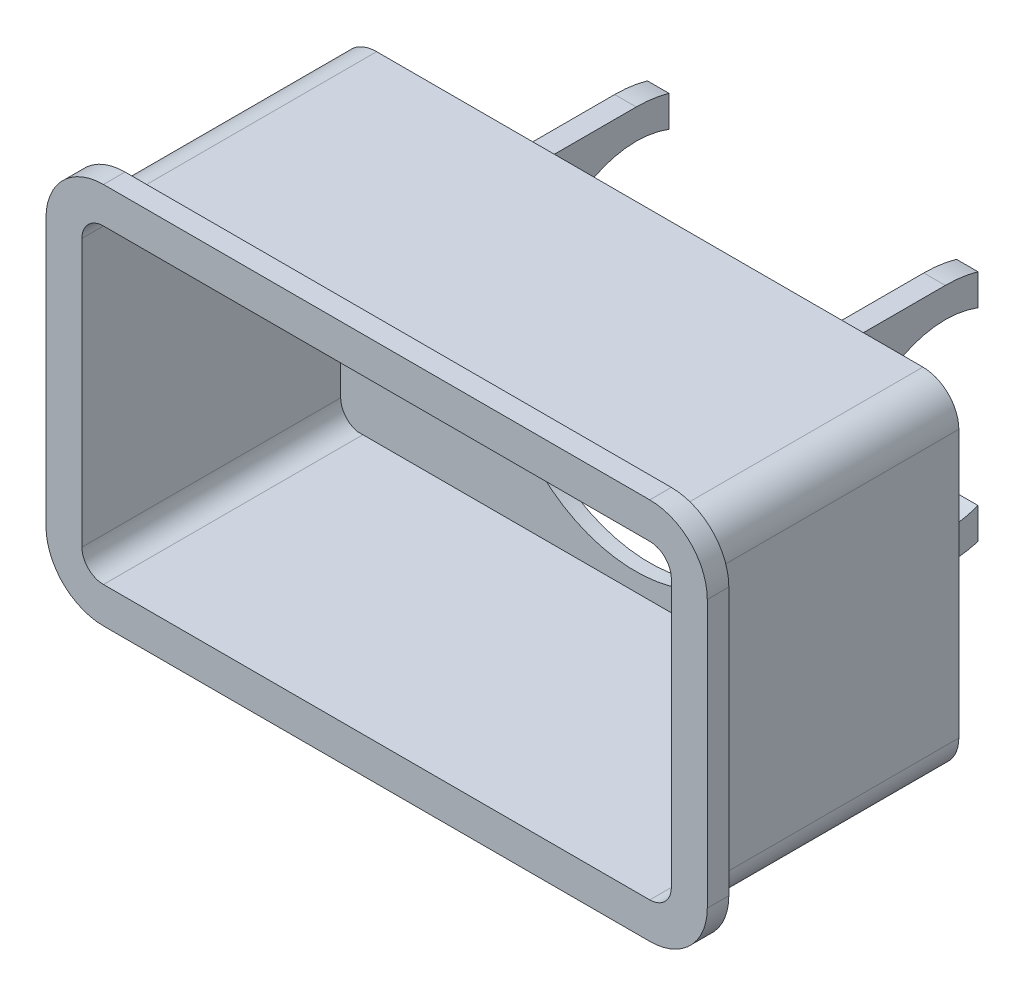
from build123d import *

# Parameters (mm, degrees)
BOSS_EXTRUDE1_DEPTH = 3
BOSS_EXTRUDE2_START = -38
BOSS_EXTRUDE2_DEPTH = 38
SKETCH3_R           = 19
BOSS_EXTRUDE3_DEPTH = 2
SKETCH4_W           = 3
SKETCH4_H           = 42
BOSS_EXTRUDE4_DEPTH = 35
CUT_EXTRUDE1_START  = -46
SKETCH5_R           = 12.75
CUT_EXTRUDE1_DEPTH  = 46
CUT_EXTRUDE2_REACH  = 103.826
CUT_EXTRUDE3_REACH  = 103.826
SKETCH7_W           = 14.582252834
SKETCH7_H           = 33.756


with BuildPart() as part:
    # Sketch1 → Boss-Extrude1 (new body)
    with BuildSketch(Plane.XY):
        with BuildLine():
            Line((-38, 26.6), (38, 26.6))
            ThreePointArc((38, 26.6), (43.656854249, 24.256854249), (46, 18.6))
            Line((46, 18.6), (46, -18.6))
            ThreePointArc((46, -18.6), (43.656854249, -24.256854249), (38, -26.6))
            Line((38, -26.6), (-38, -26.6))
            ThreePointArc((-38, -26.6), (-43.656854249, -24.256854249), (-46, -18.6))
            Line((-46, -18.6), (-46, 18.6))
            ThreePointArc((-46, 18.6), (-43.656854249, 24.256854249), (-38, 26.6))
        make_face()
        with BuildLine():
            Line((-38, -23.6), (38, -23.6))
            ThreePointArc((38, -23.6), (41.535533906, -22.135533906), (43, -18.6))
            Line((43, -18.6), (43, 18.6))
            ThreePointArc((43, 18.6), (41.535533906, 22.135533906), (38, 23.6))
            Line((38, 23.6), (-38, 23.6))
            ThreePointArc((-38, 23.6), (-41.535533906, 22.135533906), (-43, 18.6))
            Line((-43, 18.6), (-43, -18.6))
            ThreePointArc((-43, -18.6), (-41.535533906, -22.135533906), (-38, -23.6))
        make_face(mode=Mode.SUBTRACT)
    extrude(amount=BOSS_EXTRUDE1_DEPTH)

    # Sketch2 → Boss-Extrude2 (add)
    with BuildSketch(Plane.XY.offset(3).offset(BOSS_EXTRUDE2_START)):
        with BuildLine():
            Line((43, 18.6), (43, -18.6))
            ThreePointArc((43, -18.6), (41.535533906, -22.135533906), (38, -23.6))
            Line((38, -23.6), (-38, -23.6))
            ThreePointArc((-38, -23.6), (-41.535533906, -22.135533906), (-43, -18.6))
            Line((-43, -18.6), (-43, 18.6))
            ThreePointArc((-43, 18.6), (-41.535533906, 22.135533906), (-38, 23.6))
            Line((-38, 23.6), (38, 23.6))
            ThreePointArc((38, 23.6), (41.535533906, 22.135533906), (43, 18.6))
        make_face()
        with BuildLine():
            ThreePointArc((41, 18.6), (40.121320344, 20.721320344), (38, 21.6))
            Line((38, 21.6), (-38, 21.6))
            ThreePointArc((-38, 21.6), (-40.121320344, 20.721320344), (-41, 18.6))
            Line((-41, 18.6), (-41, -18.6))
            ThreePointArc((-41, -18.6), (-40.121320344, -20.721320344), (-38, -21.6))
            Line((-38, -21.6), (38, -21.6))
            ThreePointArc((38, -21.6), (40.121320344, -20.721320344), (41, -18.6))
            Line((41, -18.6), (41, 18.6))
        make_face(mode=Mode.SUBTRACT)
    extrude(amount=BOSS_EXTRUDE2_DEPTH)

    # Sketch3 → Boss-Extrude3 (add)
    with BuildSketch(Plane(origin=(0, 0, -35), x_dir=(-1, 0, 0), z_dir=(0, 0, -1))):
        with BuildLine():
            ThreePointArc((41, 18.6), (40.121320344, 20.721320344), (38, 21.6))
            Line((38, 21.6), (-38, 21.6))
            ThreePointArc((-38, 21.6), (-40.121320344, 20.721320344), (-41, 18.6))
            Line((-41, 18.6), (-41, -18.6))
            ThreePointArc((-41, -18.6), (-40.365961681, -20.444512219), (-38.731849783, -21.509363486))
            Line((-38.731849783, -21.509363486), (38.731849783, -21.509363486))
            ThreePointArc((38.731849783, -21.509363486), (40.365961681, -20.444512219), (41, -18.6))
            Line((41, -18.6), (41, 18.6))
        make_face()
        Circle(SKETCH3_R, mode=Mode.SUBTRACT)
    extrude(amount=-BOSS_EXTRUDE3_DEPTH)

    # Sketch4 → Boss-Extrude4 (add)
    with BuildSketch(Plane(origin=(0, 0, -35), x_dir=(-1, 0, 0), z_dir=(0, 0, -1))):
        with Locations((-21.5, 2.6)):
            Rectangle(SKETCH4_W, SKETCH4_H)
        with Locations((21.5, 2.6)):
            Rectangle(SKETCH4_W, SKETCH4_H)
    extrude(amount=BOSS_EXTRUDE4_DEPTH)

    # Sketch5 → Cut-Extrude1 (cut)
    with BuildSketch(Plane.ZY.offset(23).offset(CUT_EXTRUDE1_START)):
        with Locations(Location((-53.122, 0, 0), (0, 0, 270))):
            Circle(SKETCH5_R)
    extrude(amount=CUT_EXTRUDE1_DEPTH, mode=Mode.SUBTRACT)

    # Cut-Extrude2: up to this face of the body (flat: up to its plane)
    cut_extrude2_end = Plane(part.part.faces().sort_by_distance((23, -17.853282523, -52.5))[0])
    # Sketch6 → Cut-Extrude2 (cut, up to the picked face)
    with BuildSketch(Plane.ZY.offset(23), mode=Mode.PRIVATE) as cut_extrude2_sk1:
        with BuildLine():
            ThreePointArc((-53.122, -16.878), (-65.056548253, -11.934548253), (-70, 0))
            Line((-70, 0), (-70, -18.4))
            Line((-70, -18.4), (-35, -18.4))
            Line((-35, -18.4), (-35, -16.878))
            Line((-35, -16.878), (-53.122, -16.878))
        make_face()
    cut_extrude2_tool1 = split(extrude(cut_extrude2_sk1.sketch, amount=-CUT_EXTRUDE2_REACH, mode=Mode.PRIVATE), bisect_by=cut_extrude2_end, keep=Keep.BOTH, mode=Mode.PRIVATE)
    # Sketch6 → Cut-Extrude2 (cut, up to the picked face)
    with BuildSketch(Plane.ZY.offset(23), mode=Mode.PRIVATE) as cut_extrude2_sk2:
        with BuildLine():
            ThreePointArc((-70, 0), (-65.056548253, 11.934548253), (-53.122, 16.878))
            Line((-53.122, 16.878), (-35, 16.878))
            Line((-35, 16.878), (-35, 23.6))
            Line((-35, 23.6), (-70, 23.6))
            Line((-70, 23.6), (-70, 0))
        make_face()
    cut_extrude2_tool2 = split(extrude(cut_extrude2_sk2.sketch, amount=-CUT_EXTRUDE2_REACH, mode=Mode.PRIVATE), bisect_by=cut_extrude2_end, keep=Keep.BOTH, mode=Mode.PRIVATE)
    add(cut_extrude2_tool1.solids().sort_by(Axis((-23, -12.214152, -65.336152), (1, 0, 0)))[0], mode=Mode.SUBTRACT)
    add(cut_extrude2_tool2.solids().sort_by(Axis((-23, 18.768234, -55.331805), (1, 0, 0)))[0], mode=Mode.SUBTRACT)

    # Cut-Extrude3: up to this face of the body (flat: up to its plane)
    cut_extrude3_end = Plane(part.part.faces().sort_by_distance((23, 0, -35.486257909))[0])
    # Sketch7 → Cut-Extrude3 (cut, up to the picked face)
    with BuildSketch(Plane.ZY.offset(23), mode=Mode.PRIVATE) as cut_extrude3_sk1:
        with Locations((-64.958043362, 0)):
            Rectangle(SKETCH7_W, SKETCH7_H)
    cut_extrude3_tool1 = split(extrude(cut_extrude3_sk1.sketch, amount=-CUT_EXTRUDE3_REACH, mode=Mode.PRIVATE), bisect_by=cut_extrude3_end, keep=Keep.BOTH, mode=Mode.PRIVATE)
    add(cut_extrude3_tool1.solids().sort_by(Axis((-23, 0, -64.958043), (1, 0, 0)))[0], mode=Mode.SUBTRACT)


solid = part.part
